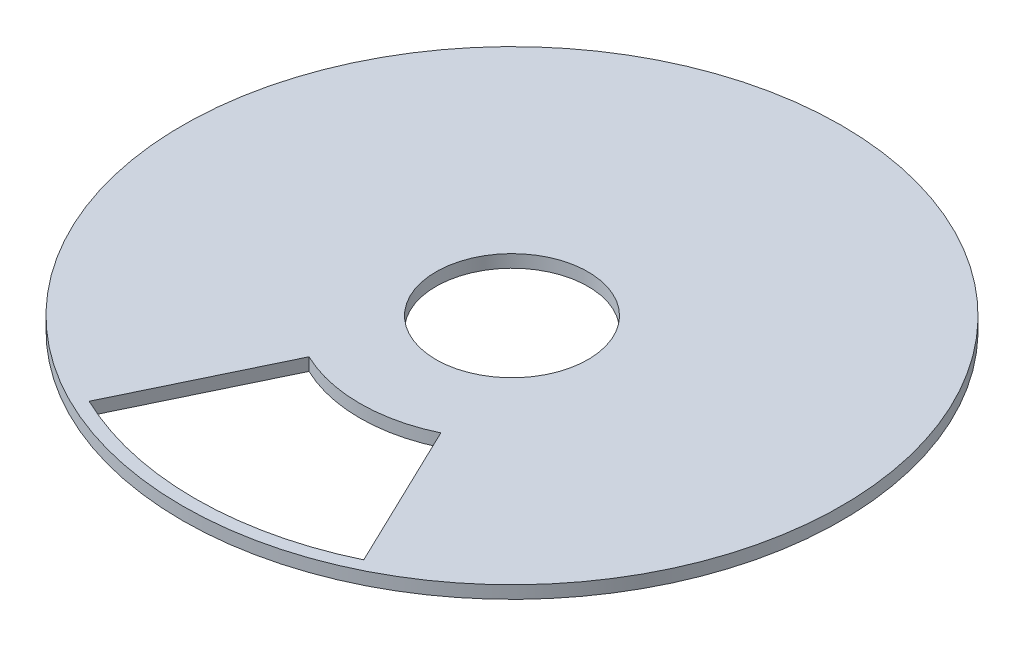
from build123d import *

# Parameters (mm, degrees)
SKETCH1_R           = 165.1
BOSS_EXTRUDE1_DEPTH = 6.35
SKETCH2_R           = 38.1
CUT_EXTRUDE1_DEPTH  = 6.35
CUT_EXTRUDE2_DEPTH  = 6.35


with BuildPart() as part:
    # Sketch1 → Boss-Extrude1 (new body)
    with BuildSketch(Plane(origin=(0, 0, 0), x_dir=(1, 0, 0), z_dir=(0, 1, 0))):
        with Locations(Location((0, 0, 0), (0, 0, 270))):
            Circle(SKETCH1_R)
    extrude(amount=BOSS_EXTRUDE1_DEPTH)

    # Sketch2 → Cut-Extrude1 (cut)
    with BuildSketch(Plane(origin=(0, 6.35, 0), x_dir=(1, 0, 0), z_dir=(0, 1, 0))):
        with Locations(Location((0, 0, 0), (0, 0, 270))):
            Circle(SKETCH2_R)
    extrude(amount=-CUT_EXTRUDE1_DEPTH, mode=Mode.SUBTRACT)

    # Sketch3 → Cut-Extrude2 (cut)
    with BuildSketch(Plane(origin=(0, 6.35, 0), x_dir=(1, 0, 0), z_dir=(0, 1, 0))):
        with BuildLine():
            Line((-33.02, -68.67400964), (-68.791666667, -143.070853416))
            ThreePointArc((-68.791666667, -143.070853416), (0, -158.75), (68.791666667, -143.070853416))
            Line((68.791666667, -143.070853416), (33.02, -68.67400964))
            ThreePointArc((33.02, -68.67400964), (0, -76.2), (-33.02, -68.67400964))
        make_face()
    extrude(amount=-CUT_EXTRUDE2_DEPTH, mode=Mode.SUBTRACT)


solid = part.part
